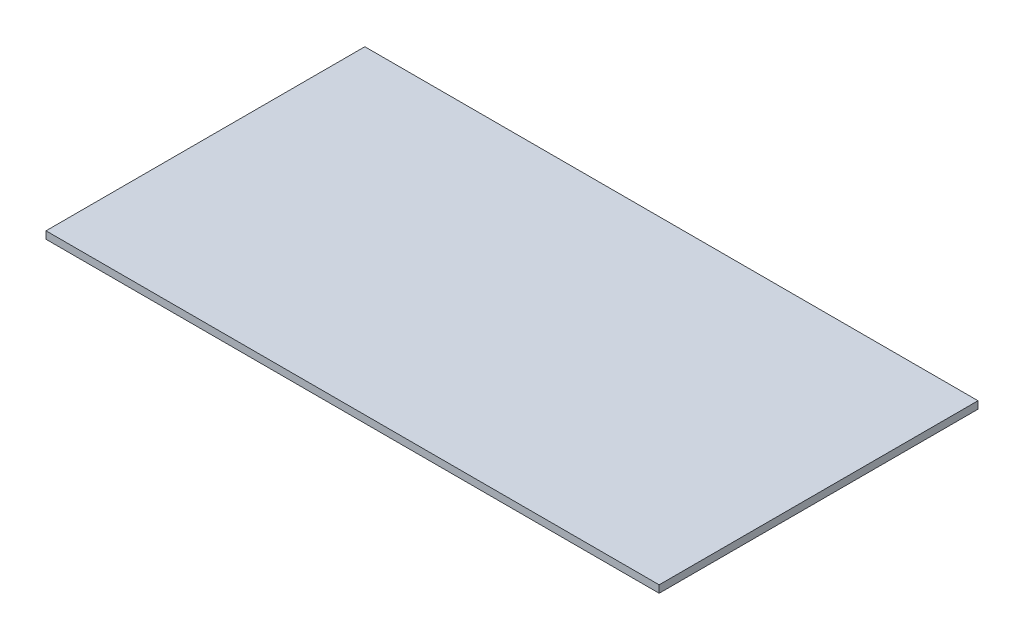
from build123d import *

# Parameters (mm, degrees)
SKETCH1_W           = 250
SKETCH1_H           = 130
BOSS_EXTRUDE1_DEPTH = 3


with BuildPart() as part:
    # Sketch1 → Boss-Extrude1 (new body)
    with BuildSketch(Plane(origin=(0, 0, 0), x_dir=(1, 0, 0), z_dir=(0, 1, 0))):
        Rectangle(SKETCH1_W, SKETCH1_H)
    extrude(amount=BOSS_EXTRUDE1_DEPTH)


solid = part.part
